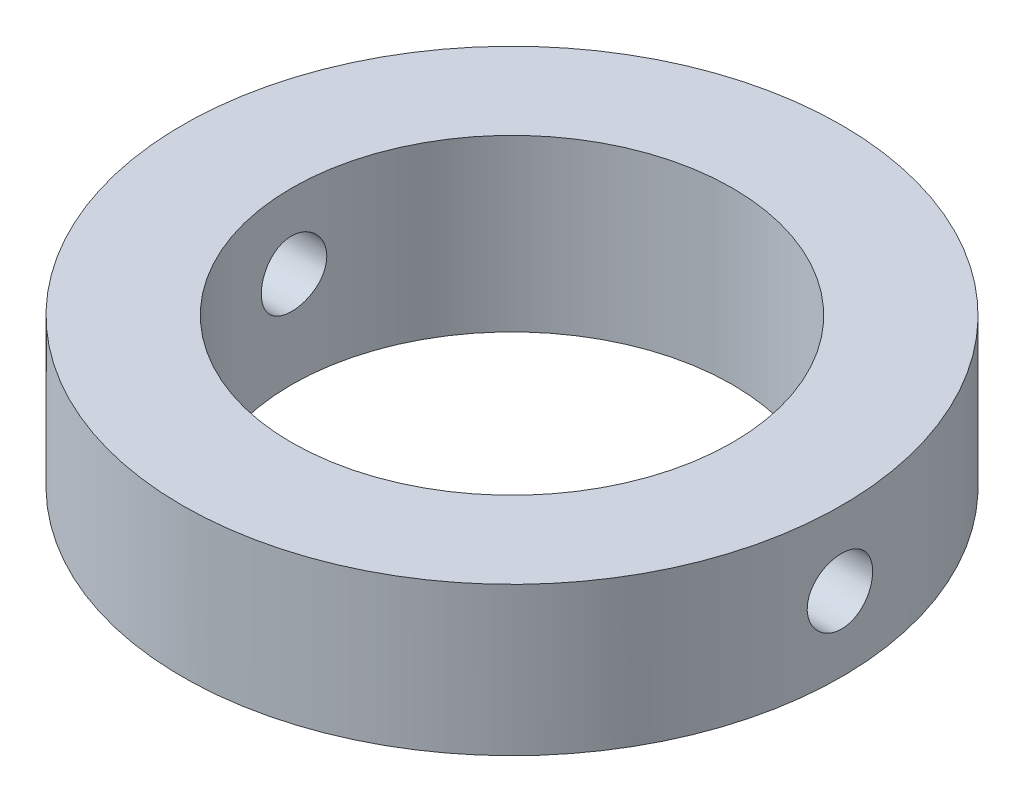
from build123d import *

# Parameters (mm, degrees)
SKETCH1_R               = 15.1
SKETCH1_R_2             = 10.1
BOSS_EXTRUDE1_DEPTH     = 7
CUT_EXTRUDE3_DEPTH      = 22
CUT_EXTRUDE3_DEPTH_BACK = 24
SKETCH4_R               = 23.353820798
SKETCH4_R_2             = 11.1
CUT_EXTRUDE4_DEPTH      = 1
SKETCH6_R               = 15.1
SKETCH6_R_2             = 10.1
BOSS_EXTRUDE2_DEPTH     = 0.8


with BuildPart() as part:
    # Sketch1 → Boss-Extrude1 (new body)
    with BuildSketch(Plane(origin=(0, 0, 0), x_dir=(1, 0, 0), z_dir=(0, 1, 0))):
        with Locations(Location((0, 0, 0), (0, 0, 270))):
            Circle(SKETCH1_R)
        with Locations(Location((0, 0, 0), (0, 0, 270))):
            Circle(SKETCH1_R_2, mode=Mode.SUBTRACT)
    extrude(amount=BOSS_EXTRUDE1_DEPTH)

    # Sketch2 → Cut-Extrude3 (cut, two sides: drawn at the far end of the back side and taken through both)
    with BuildSketch(Plane(origin=(0, 0, 0), x_dir=(0, 0, -1), z_dir=(1, 0, 0)).offset(-CUT_EXTRUDE3_DEPTH_BACK)):
        with BuildLine():
            Line((0, 5.901951984), (0, 4.401951984))
            Line((0, 4.401951984), (0, 3.5))
            Line((0, 3.5), (0, 2.901951984))
            ThreePointArc((0, 2.901951984), (1.060660172, 3.341291812), (1.5, 4.401951984))
            ThreePointArc((1.5, 4.401951984), (1.060660172, 5.462612156), (0, 5.901951984))
        make_face()
        with BuildLine():
            Line((0, 3.5), (0, 4.401951984))
            Line((0, 4.401951984), (0, 5.901951984))
            ThreePointArc((0, 5.901951984), (-1.5, 4.401951984), (0, 2.901951984))
            Line((0, 2.901951984), (0, 3.5))
        make_face()
    extrude(amount=CUT_EXTRUDE3_DEPTH + CUT_EXTRUDE3_DEPTH_BACK, mode=Mode.SUBTRACT)

    # Sketch4 → Cut-Extrude4 (cut)
    with BuildSketch(Plane.XZ):
        Circle(SKETCH4_R)
        with Locations(Location((0, 0, 0), (0, 0, 270))):
            Circle(SKETCH4_R_2, mode=Mode.SUBTRACT)
    extrude(amount=-CUT_EXTRUDE4_DEPTH, mode=Mode.SUBTRACT)

    # Sketch6 → Boss-Extrude2 (add)
    with BuildSketch(Plane(origin=(0, 7, 0), x_dir=(1, 0, 0), z_dir=(0, 1, 0))):
        with Locations(Location((0, 0, 0), (0, 0, 90))):
            Circle(SKETCH6_R)
        with Locations(Location((0, 0, 0), (0, 0, 270))):
            Circle(SKETCH6_R_2, mode=Mode.SUBTRACT)
    extrude(amount=BOSS_EXTRUDE2_DEPTH)


solid = part.part
